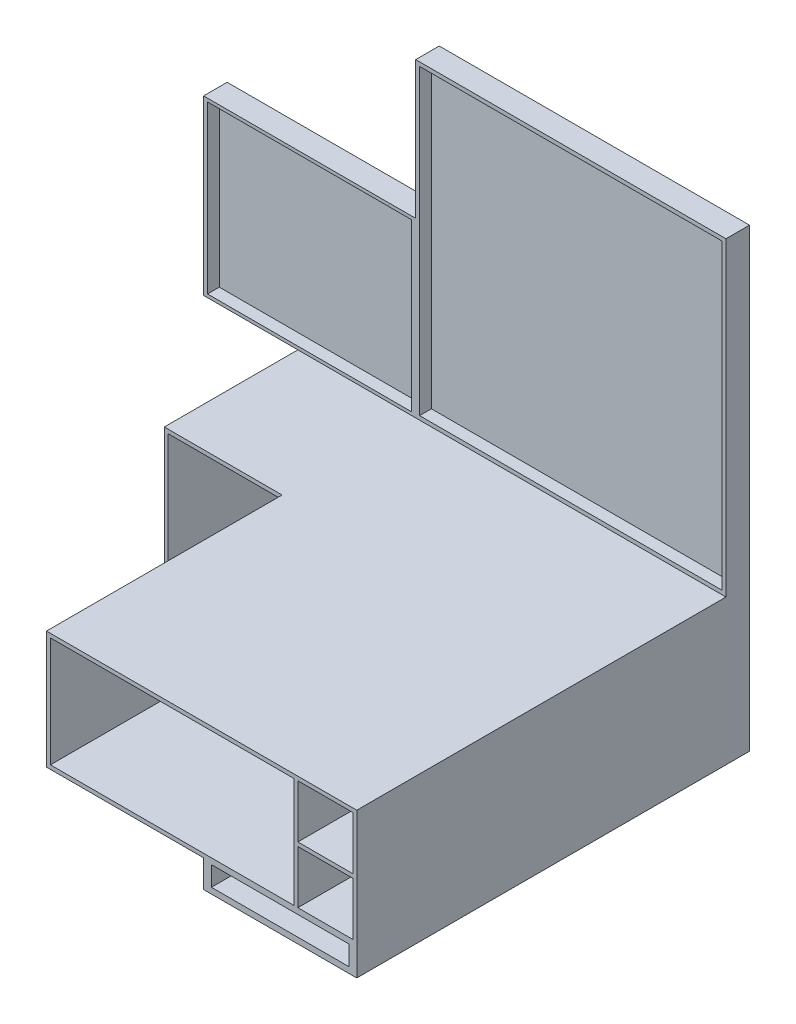
from build123d import *

# Parameters (mm, degrees)
SKETCH1_W            = 82
SKETCH1_H            = 82
BOSS_EXTRUDE1_DEPTH  = 6
SKETCH2_W            = 80
SKETCH2_H            = 80
CUT_EXTRUDE1_DEPTH   = 3
SKETCH3_W            = 82
SKETCH3_H            = 30
BOSS_EXTRUDE2_DEPTH  = 100
SKETCH4_W            = 80
SKETCH4_H            = 28
CUT_EXTRUDE2_DEPTH   = 97
SKETCH5_W            = 30
SKETCH5_H            = 30
BOSS_EXTRUDE3_DEPTH  = 40
SKETCH6_W            = 28
SKETCH6_H            = 28
CUT_EXTRUDE3_DEPTH   = 37
SKETCH7_W            = 57
SKETCH7_H            = 47
BOSS_EXTRUDE4_DEPTH  = 6
SKETCH9_W            = 55
SKETCH9_H            = 45.350877192
CUT_EXTRUDE4_DEPTH   = 3
SKETCH10_W           = 39
SKETCH10_H           = 100
BOSS_EXTRUDE6_DEPTH  = 7
SKETCH12_W           = 35
SKETCH12_H           = 5
CUT_EXTRUDE5_DEPTH   = 97
SKETCH13_W           = 55
SKETCH13_H           = 3
BOSS_EXTRUDE7_DEPTH  = 3
SKETCH14_W           = 3
SKETCH14_H           = 42.350877192
BOSS_EXTRUDE8_DEPTH  = 3
SKETCH15_W           = 6
SKETCH15_H           = 47
CUT_EXTRUDE6_DEPTH   = 3
SKETCH16_W           = 54
SKETCH16_H           = 6
CUT_EXTRUDE7_DEPTH   = 3
SKETCH17_W           = 3
SKETCH17_H           = 80
BOSS_EXTRUDE9_DEPTH  = 3
SKETCH18_W           = 77
SKETCH18_H           = 3
BOSS_EXTRUDE10_DEPTH = 3
SKETCH19_W           = 97
SKETCH19_H           = 28
BOSS_EXTRUDE11_DEPTH = 3
SKETCH20_W           = 100
SKETCH20_H           = 7
BOSS_EXTRUDE12_DEPTH = 3
SKETCH21_W           = 97
SKETCH21_H           = 5
CUT_EXTRUDE8_DEPTH   = 3
SKETCH22_W           = 97
SKETCH22_H           = 5
BOSS_EXTRUDE13_DEPTH = 3
SKETCH23_W           = 100
SKETCH23_H           = 119
CUT_EXTRUDE9_DEPTH   = 3
SKETCH24_W           = 79
SKETCH24_H           = 6
CUT_EXTRUDE10_DEPTH  = 3
SKETCH25_W           = 2
SKETCH25_H           = 28
BOSS_EXTRUDE14_DEPTH = 97
SKETCH26_W           = 13
SKETCH26_H           = 1
SKETCH26_W_2         = 1
BOSS_EXTRUDE16_DEPTH = 97
SKETCH31_W           = 97
SKETCH31_H           = 28
CUT_EXTRUDE11_DEPTH  = 1


with BuildPart() as part:
    # Sketch1 → Boss-Extrude1 (new body)
    with BuildSketch(Plane.XY):
        with Locations((41, 41)):
            Rectangle(SKETCH1_W, SKETCH1_H)
    extrude(amount=BOSS_EXTRUDE1_DEPTH)

    # Sketch2 → Cut-Extrude1 (cut)
    with BuildSketch(Plane.XY.offset(6)):
        with Locations((41, 41)):
            Rectangle(SKETCH2_W, SKETCH2_H)
    extrude(amount=-CUT_EXTRUDE1_DEPTH, mode=Mode.SUBTRACT)

    # Sketch3 → Boss-Extrude2 (add)
    with BuildSketch(Plane(origin=(0, 0, 0), x_dir=(-1, 0, 0), z_dir=(0, 0, -1))):
        with Locations((-41, -15)):
            Rectangle(SKETCH3_W, SKETCH3_H)
    extrude(amount=-BOSS_EXTRUDE2_DEPTH)

    # Sketch4 → Cut-Extrude2 (cut)
    with BuildSketch(Plane.XY.offset(100)):
        with Locations((41, -15)):
            Rectangle(SKETCH4_W, SKETCH4_H)
    extrude(amount=-CUT_EXTRUDE2_DEPTH, mode=Mode.SUBTRACT)

    # Sketch5 → Boss-Extrude3 (add)
    with BuildSketch(Plane(origin=(0, 0, 0), x_dir=(-1, 0, 0), z_dir=(0, 0, -1))):
        with Locations((15, -15)):
            Rectangle(SKETCH5_W, SKETCH5_H)
    extrude(amount=-BOSS_EXTRUDE3_DEPTH)

    # Sketch6 → Cut-Extrude3 (cut)
    with BuildSketch(Plane.XY.offset(40)):
        with Locations((-15, -15)):
            Rectangle(SKETCH6_W, SKETCH6_H)
    extrude(amount=-CUT_EXTRUDE3_DEPTH, mode=Mode.SUBTRACT)

    # Sketch7 → Boss-Extrude4 (add)
    with BuildSketch(Plane(origin=(0, 0, 0), x_dir=(-1, 0, 0), z_dir=(0, 0, -1))):
        with Locations((28.5, 23.5)):
            Rectangle(SKETCH7_W, SKETCH7_H)
    extrude(amount=-BOSS_EXTRUDE4_DEPTH)

    # Sketch9 → Cut-Extrude4 (cut)
    with BuildSketch(Plane.XY.offset(6)):
        with Locations((-28.5, 23.5)):
            Rectangle(SKETCH9_W, SKETCH9_H)
    extrude(amount=-CUT_EXTRUDE4_DEPTH, mode=Mode.SUBTRACT)

    # Sketch10 → Boss-Extrude6 (add)
    with BuildSketch(Plane(origin=(0, -30, 0), x_dir=(-1, 0, 0), z_dir=(0, -1, 0))):
        with Locations((-62.5, -50)):
            Rectangle(SKETCH10_W, SKETCH10_H)
    extrude(amount=BOSS_EXTRUDE6_DEPTH)

    # Sketch12 → Cut-Extrude5 (cut)
    with BuildSketch(Plane.XY.offset(100)):
        with Locations((62.5, -33)):
            Rectangle(SKETCH12_W, SKETCH12_H)
    extrude(amount=-CUT_EXTRUDE5_DEPTH, mode=Mode.SUBTRACT)

    # Sketch13 → Boss-Extrude7 (add)
    with BuildSketch(Plane.XZ.offset(-46.175438596)):
        with Locations((-28.5, 4.5)):
            Rectangle(SKETCH13_W, SKETCH13_H)
    extrude(amount=BOSS_EXTRUDE7_DEPTH)

    # Sketch14 → Boss-Extrude8 (add)
    with BuildSketch(Plane(origin=(-56, 0, 0), x_dir=(0, 0, -1), z_dir=(1, 0, 0))):
        with Locations((-4.5, 22)):
            Rectangle(SKETCH14_W, SKETCH14_H)
    extrude(amount=BOSS_EXTRUDE8_DEPTH)

    # Sketch15 → Cut-Extrude6 (cut)
    with BuildSketch(Plane.ZY.offset(57)):
        with Locations((3, 23.5)):
            Rectangle(SKETCH15_W, SKETCH15_H)
    extrude(amount=-CUT_EXTRUDE6_DEPTH, mode=Mode.SUBTRACT)

    # Sketch16 → Cut-Extrude7 (cut)
    with BuildSketch(Plane(origin=(0, 47, 0), x_dir=(1, 0, 0), z_dir=(0, 1, 0))):
        with Locations((-27, -3)):
            Rectangle(SKETCH16_W, SKETCH16_H)
    extrude(amount=-CUT_EXTRUDE7_DEPTH, mode=Mode.SUBTRACT)

    # Sketch17 → Boss-Extrude9 (add)
    with BuildSketch(Plane.ZY.offset(-81)):
        with Locations((4.5, 41)):
            Rectangle(SKETCH17_W, SKETCH17_H)
    extrude(amount=BOSS_EXTRUDE9_DEPTH)

    # Sketch18 → Boss-Extrude10 (add)
    with BuildSketch(Plane.XZ.offset(-81)):
        with Locations((39.5, 4.5)):
            Rectangle(SKETCH18_W, SKETCH18_H)
    extrude(amount=BOSS_EXTRUDE10_DEPTH)

    # Sketch19 → Boss-Extrude11 (add)
    with BuildSketch(Plane.ZY.offset(-81)):
        with Locations((51.5, -15)):
            Rectangle(SKETCH19_W, SKETCH19_H)
    extrude(amount=BOSS_EXTRUDE11_DEPTH)

    # Sketch20 → Boss-Extrude12 (add)
    with BuildSketch(Plane.ZY.offset(-43)):
        with Locations((50, -33.5)):
            Rectangle(SKETCH20_W, SKETCH20_H)
    extrude(amount=BOSS_EXTRUDE12_DEPTH)

    # Sketch21 → Cut-Extrude8 (cut)
    with BuildSketch(Plane(origin=(45, 0, 0), x_dir=(0, 0, -1), z_dir=(1, 0, 0))):
        with Locations((-51.5, -33)):
            Rectangle(SKETCH21_W, SKETCH21_H)
    extrude(amount=-CUT_EXTRUDE8_DEPTH, mode=Mode.SUBTRACT)

    # Sketch22 → Boss-Extrude13 (add)
    with BuildSketch(Plane.ZY.offset(-80)):
        with Locations((51.5, -33)):
            Rectangle(SKETCH22_W, SKETCH22_H)
    extrude(amount=BOSS_EXTRUDE13_DEPTH)

    # Sketch23 → Cut-Extrude9 (cut)
    with BuildSketch(Plane(origin=(82, 0, 0), x_dir=(0, 0, -1), z_dir=(1, 0, 0))):
        with Locations((-50, 22.5)):
            Rectangle(SKETCH23_W, SKETCH23_H)
    extrude(amount=-CUT_EXTRUDE9_DEPTH, mode=Mode.SUBTRACT)

    # Sketch24 → Cut-Extrude10 (cut)
    with BuildSketch(Plane(origin=(0, 82, 0), x_dir=(1, 0, 0), z_dir=(0, 1, 0))):
        with Locations((39.5, -3)):
            Rectangle(SKETCH24_W, SKETCH24_H)
    extrude(amount=-CUT_EXTRUDE10_DEPTH, mode=Mode.SUBTRACT)

    # Sketch25 → Boss-Extrude14 (add)
    with BuildSketch(Plane.XY.offset(3)):
        with Locations((63, -15)):
            Rectangle(SKETCH25_W, SKETCH25_H)
    extrude(amount=BOSS_EXTRUDE14_DEPTH)

    # Sketch26 → Boss-Extrude16 (add)
    with BuildSketch(Plane.XY.offset(3)):
        with Locations((70.5, -15)):
            Rectangle(SKETCH26_W, SKETCH26_H)
        with Locations((77.5, -15)):
            Rectangle(SKETCH26_W_2, SKETCH26_H)
    extrude(amount=BOSS_EXTRUDE16_DEPTH)

    # Sketch31 → Cut-Extrude11 (cut)
    with BuildSketch(Plane.ZY.offset(-62)):
        with Locations((51.5, -15)):
            Rectangle(SKETCH31_W, SKETCH31_H)
    extrude(amount=-CUT_EXTRUDE11_DEPTH, mode=Mode.SUBTRACT)


solid = part.part
